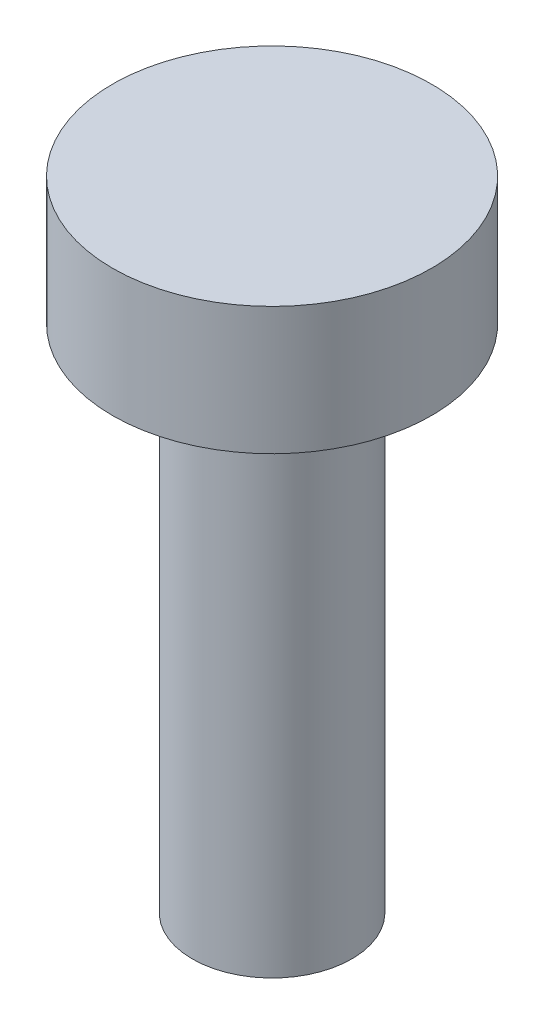
from build123d import *


with BuildPart() as part:
    # Sketch1 → Revolve1 (revolve)
    with BuildSketch(Plane.XY, mode=Mode.PRIVATE) as revolve1_sk:
        Polygon((0, 0), (1.25, 0), (1.25, 8), (2.5, 8), (2.5, 10), (0, 10), align=None)
    revolve(revolve1_sk.sketch.rotate(Axis((0, 10, 0), (0, -1, 0)), 90), axis=Axis((0, 10, 0), (0, -1, 0)))


solid = part.part
